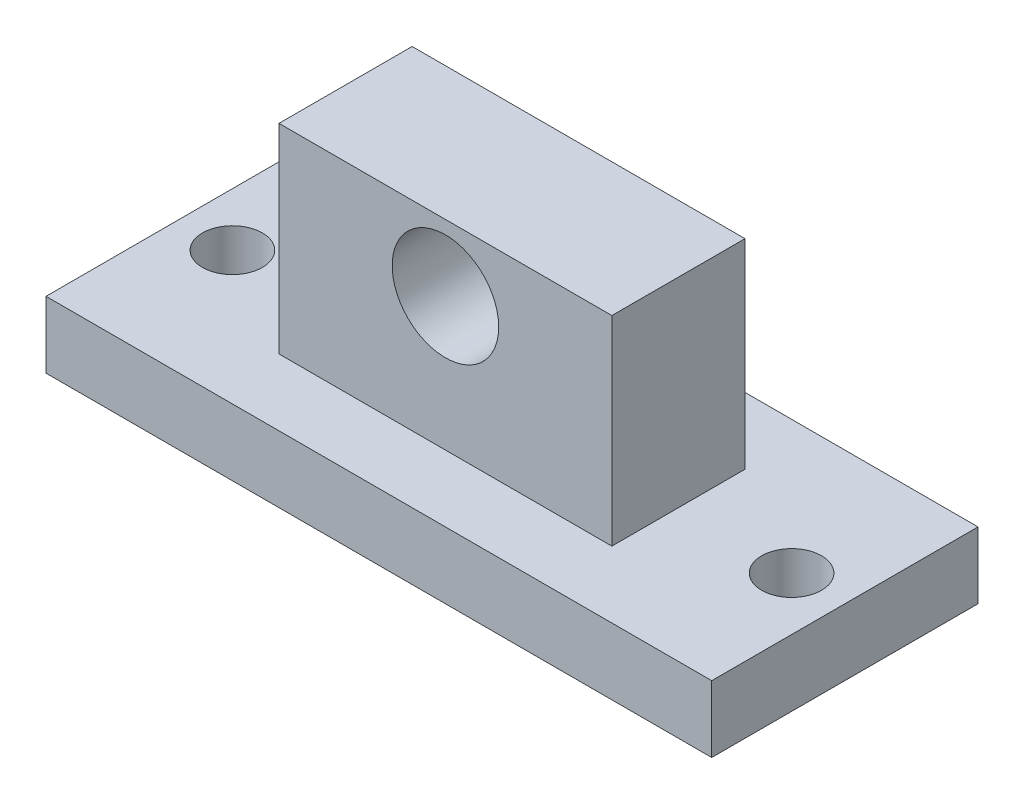
from build123d import *

# Parameters (mm, degrees)
SKETCH1_W           = 50
SKETCH1_H           = 20
BOSS_EXTRUDE1_DEPTH = 5
SKETCH2_R           = 2.25
CUT_EXTRUDE1_DEPTH  = 5
SKETCH3_W           = 25
SKETCH3_H           = 10
BOSS_EXTRUDE2_DEPTH = 15
SKETCH4_R           = 4
CUT_EXTRUDE2_DEPTH  = 15


with BuildPart() as part:
    # Sketch1 → Boss-Extrude1 (new body)
    with BuildSketch(Plane(origin=(0, 0, 0), x_dir=(1, 0, 0), z_dir=(0, 1, 0))):
        Rectangle(SKETCH1_W, SKETCH1_H)
    extrude(amount=BOSS_EXTRUDE1_DEPTH)

    # Sketch2 → Cut-Extrude1 (cut)
    with BuildSketch(Plane(origin=(0, 5, 0), x_dir=(1, 0, 0), z_dir=(0, 1, 0))):
        with Locations(Location((-21, 0, 0), (0, 0, 270))):
            Circle(SKETCH2_R)
        with Locations(Location((21, 0, 0), (0, 0, 270))):
            Circle(SKETCH2_R)
    extrude(amount=-CUT_EXTRUDE1_DEPTH, mode=Mode.SUBTRACT)

    # Sketch3 → Boss-Extrude2 (add)
    with BuildSketch(Plane(origin=(0, 5, 0), x_dir=(1, 0, 0), z_dir=(0, 1, 0))):
        Rectangle(SKETCH3_W, SKETCH3_H)
    extrude(amount=BOSS_EXTRUDE2_DEPTH)

    # Sketch4 → Cut-Extrude2 (cut)
    with BuildSketch(Plane.XY.offset(5)):
        with Locations((0, 15)):
            Circle(SKETCH4_R)
    extrude(amount=-CUT_EXTRUDE2_DEPTH, mode=Mode.SUBTRACT)


solid = part.part
